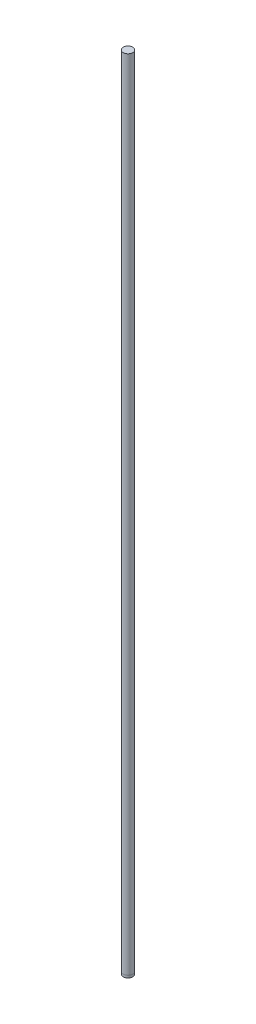
from build123d import *

# Parameters (mm, degrees)
SKETCH1_R           = 6
BOSS_EXTRUDE1_DEPTH = 1000
BOSS_EXTRUDE2_START = 3
SKETCH2_R           = 6
BOSS_EXTRUDE2_DEPTH = 3
SKETCH3_R           = 5.970774837
BOSS_EXTRUDE3_DEPTH = 3


with BuildPart() as part:
    # Sketch1 → Boss-Extrude1 (new body)
    with BuildSketch(Plane(origin=(0, 0, 0), x_dir=(1, 0, 0), z_dir=(0, 1, 0))):
        with Locations(Location((0, 0, 0), (0, 0, 270))):
            Circle(SKETCH1_R)
    extrude(amount=BOSS_EXTRUDE1_DEPTH)

    # Sketch2 → Boss-Extrude2 (add)
    with BuildSketch(Plane(origin=(0, 0, 0), x_dir=(-1, 0, 0), z_dir=(0, -1, 0)).offset(BOSS_EXTRUDE2_START)):
        with Locations(Location((0, 0, 0), (0, 0, 90))):
            Circle(SKETCH2_R)
    extrude(amount=-BOSS_EXTRUDE2_DEPTH)

    # Sketch3 → Boss-Extrude3 (add)
    with BuildSketch(Plane(origin=(0, -3, 0), x_dir=(-1, 0, 0), z_dir=(0, -1, 0))):
        with Locations(Location((0, 0, 0), (0, 0, 90))):
            Circle(SKETCH3_R)
    extrude(amount=BOSS_EXTRUDE3_DEPTH)


solid = part.part
